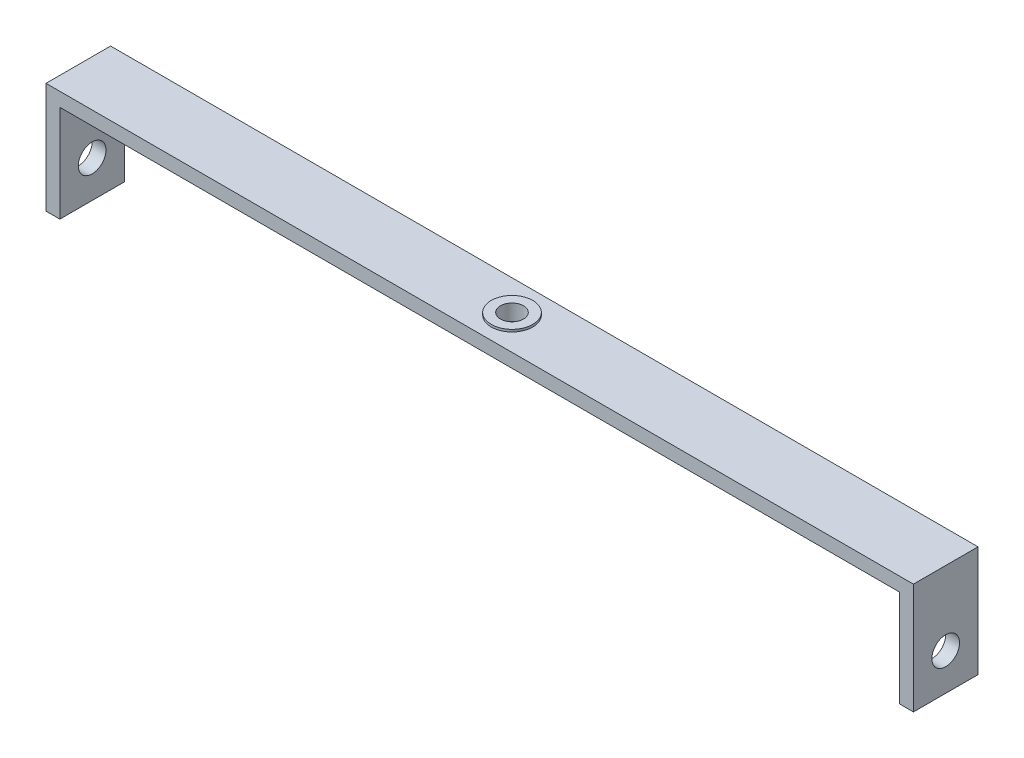
from build123d import *

# Parameters (mm, degrees)
BOSS_EXTRUDE1_DEPTH     = 3.5
CUT_EXTRUDE1_DEPTH      = 49.633835958
CUT_EXTRUDE1_DEPTH_BACK = 1.5
SKETCH2_R               = 1.25
SKETCH3_R               = 2.25
SKETCH3_R_2             = 1.25
BOSS_EXTRUDE2_DEPTH     = 0.25
CUT_EXTRUDE2_DEPTH      = 49.633835958
CUT_EXTRUDE2_DEPTH_BACK = 49.633835958
SKETCH4_R               = 1.5
SCALE1_SCALE            = 18


with BuildPart() as part:
    # Sketch1 → Boss-Extrude1 (new, symmetric)
    with BuildSketch(Plane.XY):
        Polygon((-47, -12), (-47, 0), (47, 0), (47, -12), (45.5, -12), (45.5, -1.5), (-45.5, -1.5), (-45.5, -12), align=None)
    extrude(amount=BOSS_EXTRUDE1_DEPTH, both=True)

    # Sketch2 → Cut-Extrude1 (cut, two sides: drawn at the far end of the back side and taken through both)
    with BuildSketch(Plane(origin=(0, 0, 0), x_dir=(1, 0, 0), z_dir=(0, 1, 0)).offset(-CUT_EXTRUDE1_DEPTH_BACK)):
        with Locations(Location((0, 0, 0), (0, 0, 270))):
            Circle(SKETCH2_R)
    extrude(amount=CUT_EXTRUDE1_DEPTH + CUT_EXTRUDE1_DEPTH_BACK, mode=Mode.SUBTRACT)

    # Sketch3 → Boss-Extrude2 (add, symmetric)
    with BuildSketch(Plane(origin=(0, 0, 0), x_dir=(1, 0, 0), z_dir=(0, 1, 0))):
        Circle(SKETCH3_R)
        with Locations(Location((0, 0, 0), (0, 0, 180))):
            Circle(SKETCH3_R_2, mode=Mode.SUBTRACT)
    extrude(amount=BOSS_EXTRUDE2_DEPTH, both=True)

    # Sketch4 → Cut-Extrude2 (cut, two sides: drawn at the far end of the back side and taken through both)
    with BuildSketch(Plane(origin=(0, 0, 0), x_dir=(0, 0, -1), z_dir=(1, 0, 0)).offset(-CUT_EXTRUDE2_DEPTH_BACK)):
        with Locations((0, -8)):
            Circle(SKETCH4_R)
    extrude(amount=CUT_EXTRUDE2_DEPTH + CUT_EXTRUDE2_DEPTH_BACK, mode=Mode.SUBTRACT)


with BuildPart() as part_1:
    # Scale1: scaled about (0, -1.737452604, 0)
    add(part.part.scale(SCALE1_SCALE).moved(Location((0, 29.536694268, 0))))


solid = part_1.part
